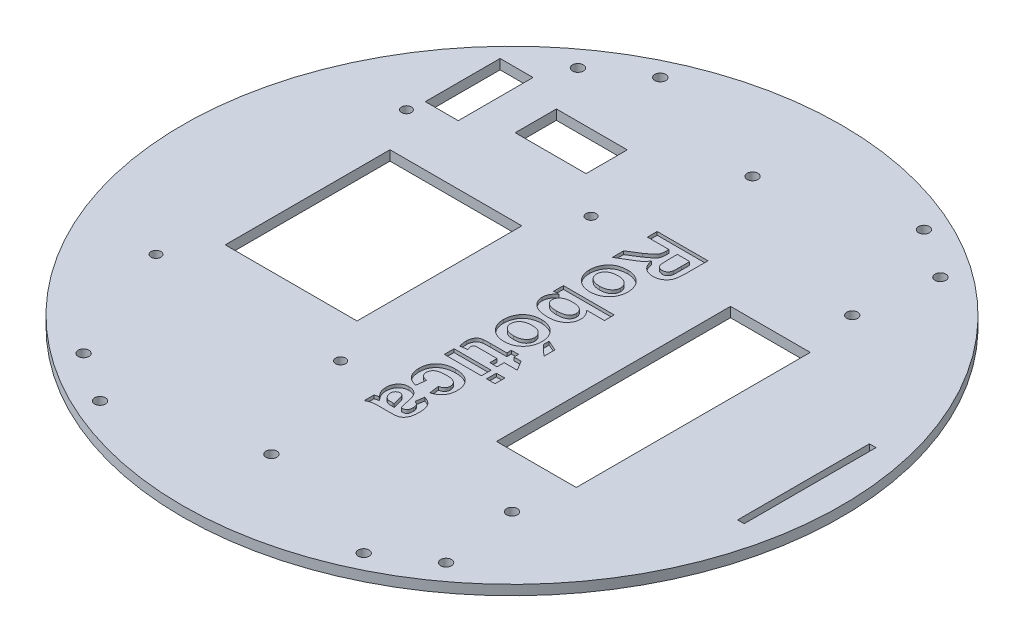
from build123d import *

# Parameters (mm, degrees)
CROQUIS1_R              = 100
CROQUIS1_R_2            = 1.65
CROQUIS1_R_3            = 1.5
CROQUIS1_W              = 24.2
CROQUIS1_H              = 71
CROQUIS1_W_2            = 10
CROQUIS1_H_2            = 22.7
CROQUIS1_W_3            = 21.5
CROQUIS1_H_3            = 12.5
CROQUIS1_W_4            = 40
CROQUIS1_H_4            = 50
CROQUIS1_W_5            = 2
CROQUIS1_H_5            = 40
SALIENTE_EXTRUIR1_DEPTH = 3
CROQUIS2_W              = 2.568318685
CROQUIS2_H              = 2.963444636
CROQUIS2_W_2            = 11.261089618
CORTAR_EXTRUIR1_DEPTH   = 1


with BuildPart() as part:
    # Croquis1 → Saliente-Extruir1 (new body)
    with BuildSketch(Plane(origin=(0, 0, 0), x_dir=(1, 0, 0), z_dir=(0, 1, 0))):
        with Locations(Location((0, 0, 0), (0, 0, 270))):
            Circle(CROQUIS1_R)
        with Locations(Location((55, 75, 0), (0, 0, 270))):
            Circle(CROQUIS1_R_2, mode=Mode.SUBTRACT)
        with Locations(Location((55, -75, 0), (0, 0, 90))):
            Circle(CROQUIS1_R_2, mode=Mode.SUBTRACT)
        with Locations(Location((0, -73, 0), (0, 0, 270))):
            Circle(CROQUIS1_R_2, mode=Mode.SUBTRACT)
        with Locations(Location((51.618795027, -51.618795027, 0), (0, 0, 270))):
            Circle(CROQUIS1_R_2, mode=Mode.SUBTRACT)
        with Locations(Location((51.618795027, 51.618795027, 0), (0, 0, 270))):
            Circle(CROQUIS1_R_2, mode=Mode.SUBTRACT)
        with Locations(Location((0, 73, 0), (0, 0, 270))):
            Circle(CROQUIS1_R_2, mode=Mode.SUBTRACT)
        with Locations(Location((40, -85, 0), (0, 0, 270))):
            Circle(CROQUIS1_R_2, mode=Mode.SUBTRACT)
        with Locations(Location((40, 85, 0), (0, 0, 90))):
            Circle(CROQUIS1_R_2, mode=Mode.SUBTRACT)
        with Locations(Location((-70.020295338, 38, 0), (0, 0, 270))):
            Circle(CROQUIS1_R_3, mode=Mode.SUBTRACT)
        with Locations(Location((-14.020295338, 38, 0), (0, 0, 270))):
            Circle(CROQUIS1_R_3, mode=Mode.SUBTRACT)
        with Locations(Location((-14.020295338, -38, 0), (0, 0, 90))):
            Circle(CROQUIS1_R_3, mode=Mode.SUBTRACT)
        with Locations(Location((-70.020295338, -38, 0), (0, 0, 90))):
            Circle(CROQUIS1_R_3, mode=Mode.SUBTRACT)
        with Locations(Location((-40, -85, 0), (0, 0, 90))):
            Circle(CROQUIS1_R_2, mode=Mode.SUBTRACT)
        with Locations(Location((-55, -75, 0), (0, 0, 270))):
            Circle(CROQUIS1_R_2, mode=Mode.SUBTRACT)
        with Locations(Location((-55, 75, 0), (0, 0, 90))):
            Circle(CROQUIS1_R_2, mode=Mode.SUBTRACT)
        with Locations(Location((-40, 85, 0), (0, 0, 270))):
            Circle(CROQUIS1_R_2, mode=Mode.SUBTRACT)
        with Locations((42.9, 0)):
            Rectangle(CROQUIS1_W, CROQUIS1_H, mode=Mode.SUBTRACT)
        with Locations((-64.299296542, 54.335107278)):
            Rectangle(CROQUIS1_W_2, CROQUIS1_H_2, mode=Mode.SUBTRACT)
        with Locations((-36.742208882, 54.713188989)):
            Rectangle(CROQUIS1_W_3, CROQUIS1_H_3, mode=Mode.SUBTRACT)
        with Locations((-42.020295338, 0)):
            Rectangle(CROQUIS1_W_4, CROQUIS1_H_4, mode=Mode.SUBTRACT)
        with Locations((89, 0.459343657)):
            Rectangle(CROQUIS1_W_5, CROQUIS1_H_5, mode=Mode.SUBTRACT)
    extrude(amount=SALIENTE_EXTRUIR1_DEPTH)

    # Croquis2 → Cortar-Extruir1 (cut)
    # profile 1 of 10: a face of its own
    with BuildSketch(Plane(origin=(0, 3, 0), x_dir=(1, 0, 0), z_dir=(0, 1, 0))):
        with BuildLine():
            Line((0, 44.056543595), (15.409912109, 44.056543595))
            Line((15.409912109, 44.056543595), (15.409912109, 37.58944306))
            add(Edge.make_bspline(
                [(15.409912109, 37.58944306), (15.408700139, 37.392901619), (15.406364449, 37.01413029), (15.389351015, 36.466350859), (15.353656515, 35.96118308), (15.313369891, 35.496351667), (15.254130983, 35.073199675), (15.184575295, 34.690710004), (15.102371123, 34.350116278), (15.005589025, 34.047662408), (14.89220702, 33.772955118), (14.759999786, 33.516154901), (14.603923989, 33.274834845), (14.430534785, 33.045831307), (14.239368077, 32.828255327), (14.025418076, 32.628050057), (13.79185615, 32.44173331), (13.5406295, 32.269453804), (13.272846352, 32.11768643), (12.997106922, 31.979010873), (12.710476846, 31.866123744), (12.414306386, 31.77288), (12.109238565, 31.698395459), (11.794497787, 31.646696895), (11.470653745, 31.614422038), (11.251906484, 31.611540857), (11.14069968, 31.610076122)],
                knots=[0, 0, 0, 0, 1.675792322, 3.229558513, 4.671612708, 5.993327294, 7.206773438, 8.313218507, 9.306927966, 10.191988363, 11.018030861, 11.838135071, 12.650980327, 13.465150207, 14.285535933, 15.117196726, 15.959844754, 16.83101188, 17.711363548, 18.582398133, 19.460517458, 20.334551361, 21.228266118, 22.135486512, 23.052118027, 24, 24, 24, 24], degree=3))
            add(Edge.make_bspline(
                [(11.14069968, 31.610076122), (11.000599617, 31.612759295), (10.72680548, 31.618002956), (10.325687671, 31.667336031), (9.941481852, 31.738245618), (9.577492248, 31.847861189), (9.230980803, 31.984155425), (8.904382122, 32.150674809), (8.5946336, 32.347195417), (8.306114692, 32.574728563), (8.038244285, 32.832361257), (7.796875347, 33.121547022), (7.579485208, 33.440374803), (7.392576035, 33.791453862), (7.227856809, 34.168732285), (7.092522492, 34.577179336), (6.981283029, 35.01468756), (6.929076027, 35.319102281), (6.902356466, 35.474901835)],
                knots=[0, 0, 0, 0, 1.059179627, 2.069928931, 3.052909591, 4.01082991, 4.940120368, 5.865982481, 6.779263376, 7.710344595, 8.640547144, 9.585223395, 10.554458868, 11.553878165, 12.589111246, 13.664634927, 14.804759383, 16, 16, 16, 16], degree=3))
            add(Edge.make_bspline(
                [(6.902356466, 35.474901835), (6.802810616, 35.324033949), (6.608430531, 35.02943892), (6.283482022, 34.624214802), (5.949212712, 34.255013926), (5.647683016, 33.977843153), (5.383771386, 33.764654987), (5.152835883, 33.593099202), (4.88709982, 33.40801717), (4.586375223, 33.211263384), (4.25333668, 32.997008803), (3.882882181, 32.773225785), (3.478626524, 32.535230155), (3.196233421, 32.375215871), (3.049878438, 32.292285772)],
                knots=[0, 0, 0, 0, 1.285482994, 2.510122655, 3.691653098, 4.826411195, 5.419869803, 6.105175889, 6.872935239, 7.723789235, 8.662129684, 9.690525463, 10.803075916, 12, 12, 12, 12], degree=3))
            Line((3.049878438, 32.292285772), (0, 30.424698267))
            Line((0, 30.424698267), (0, 33.888224186))
            Line((0, 33.888224186), (3.497482055, 36.079938448))
            add(Edge.make_bspline(
                [(3.497482055, 36.079938448), (3.637579979, 36.180560682), (3.905055719, 36.372669213), (4.284737049, 36.650527393), (4.624620583, 36.90327335), (4.922628616, 37.131197719), (5.181863001, 37.331531764), (5.395845399, 37.511128653), (5.574840785, 37.661179522), (5.752121404, 37.831220018), (5.934547724, 38.028873802), (6.110117883, 38.27330232), (6.252756198, 38.522653774), (6.359881675, 38.792397306), (6.43396371, 39.105088115), (6.482276325, 39.480465328), (6.517357105, 39.929711289), (6.518800304, 40.254400593), (6.5195782, 40.429410837)],
                knots=[0, 0, 0, 0, 1.465382114, 2.797715724, 3.99708711, 5.063614826, 5.985194575, 6.779875669, 7.43696127, 7.968700361, 8.866038685, 9.717629234, 10.520014012, 11.30082289, 12.174340694, 13.242479345, 14.513673363, 16, 16, 16, 16], degree=3))
            Line((6.5195782, 40.429410837), (6.5195782, 41.093098958))
            Line((6.5195782, 41.093098958), (0, 41.093098958))
            Line((0, 41.093098958), (0, 44.056543595))
        make_face()
        with BuildLine():
            Line((9.087896885, 41.093098958), (9.087896885, 38.706908642))
            add(Edge.make_bspline(
                [(9.087896885, 38.706908642), (9.088287797, 38.522713205), (9.089032551, 38.171789772), (9.099974618, 37.672773199), (9.10904285, 37.227998798), (9.132696583, 36.838128637), (9.155258098, 36.502349434), (9.18537091, 36.221084541), (9.2207214, 35.993968954), (9.27571103, 35.767121757), (9.37150864, 35.534743605), (9.507969633, 35.287111188), (9.684943618, 35.075331973), (9.88973085, 34.892378098), (10.129434073, 34.751153944), (10.397162987, 34.647583903), (10.692365394, 34.585732993), (10.898592997, 34.577674044), (11.004875134, 34.573520758)],
                knots=[0, 0, 0, 0, 1.698120923, 3.235207303, 4.601799022, 5.7989489, 6.835765357, 7.704239165, 8.40605236, 8.953649664, 9.852072573, 10.714567413, 11.550246753, 12.383769498, 13.234656382, 14.099651817, 15.020630301, 16, 16, 16, 16], degree=3))
            add(Edge.make_bspline(
                [(11.004875134, 34.573520758), (11.123691124, 34.578679343), (11.352927417, 34.588632), (11.677985231, 34.669611839), (11.967764752, 34.804409725), (12.217192243, 34.996867033), (12.429998406, 35.237242284), (12.595951853, 35.525782418), (12.722054455, 35.856249006), (12.768125755, 36.094394663), (12.792202681, 36.218849916)],
                knots=[0, 0, 0, 0, 1.062451802, 2.049829439, 2.976851779, 3.903462222, 4.849641532, 5.832195941, 6.867102576, 8, 8, 8, 8], degree=3))
            add(Edge.make_bspline(
                [(12.792202681, 36.218849916), (12.796721703, 36.259977358), (12.807432735, 36.357458032), (12.814311959, 36.529597345), (12.824886077, 36.749699541), (12.829207483, 37.020428737), (12.836782527, 37.339366254), (12.838173496, 37.70778033), (12.842617545, 38.124500484), (12.841947294, 38.418794186), (12.841593424, 38.574171017)],
                knots=[0, 0, 0, 0, 0.42127143, 0.998501726, 1.753681744, 2.66564073, 3.755712164, 5.002818897, 6.417592707, 8, 8, 8, 8], degree=3))
            Line((12.841593424, 38.574171017), (12.841593424, 41.093098958))
            Line((12.841593424, 41.093098958), (9.087896885, 41.093098958))
        make_face(mode=Mode.SUBTRACT)
    # profile 2 of 10: a face of its own
    with BuildSketch(Plane(origin=(0, 3, 0), x_dir=(1, 0, 0), z_dir=(0, 1, 0))):
        with BuildLine():
            add(Edge.make_bspline(
                [(5.787977806, 29.436883388), (6.031343705, 29.427309614), (6.518547235, 29.408143507), (7.242878708, 29.273126249), (7.951411517, 29.038968189), (8.525243796, 28.779609283), (8.968971023, 28.531459875), (9.282093799, 28.320887573), (9.578631102, 28.096006215), (9.849943669, 27.846863815), (10.10399132, 27.581948554), (10.336219217, 27.29699471), (10.54618146, 26.992647263), (10.737961311, 26.672386941), (10.905250038, 26.3369018), (11.056349725, 25.99300478), (11.178361623, 25.637164013), (11.280403075, 25.27231632), (11.362084313, 24.897392419), (11.415599834, 24.512392378), (11.451273379, 24.117754224), (11.456170218, 23.851693285), (11.458652594, 23.716817856)],
                knots=[0, 0, 0, 0, 1.620086906, 3.24331412, 4.885542897, 6.578005083, 7.427771567, 8.267621014, 9.088420958, 9.9031946, 10.717276681, 11.530464626, 12.347654122, 13.177156876, 14.013590352, 14.842102317, 15.676260085, 16.515690285, 17.363576751, 18.228778874, 19.102107167, 20, 20, 20, 20], degree=3))
            add(Edge.make_bspline(
                [(11.458652594, 23.716817856), (11.454267138, 23.511809641), (11.44564005, 23.108516544), (11.367088975, 22.518108154), (11.237604413, 21.956862167), (11.057560605, 21.423843835), (10.825488748, 20.918495221), (10.540220114, 20.441875582), (10.204185516, 19.993696617), (9.819759083, 19.580722035), (9.398381958, 19.20373864), (8.944142898, 18.875682398), (8.461611024, 18.600655775), (7.955925649, 18.368485743), (7.420206891, 18.193185307), (6.857228462, 18.071798056), (6.268806062, 17.990588865), (5.866459824, 17.982402681), (5.661414024, 17.978230794)],
                knots=[0, 0, 0, 0, 1.075924834, 2.116564253, 3.120359295, 4.095843642, 5.065160291, 6.034266158, 7.006679049, 8.000613031, 8.991650547, 9.970718501, 10.936294465, 11.903365421, 12.887384013, 13.888792113, 14.924075166, 16, 16, 16, 16], degree=3))
            add(Edge.make_bspline(
                [(5.661414024, 17.978230794), (5.454315166, 17.982409763), (5.048899281, 17.990590496), (4.455078454, 18.071450183), (3.886886153, 18.195900643), (3.347002526, 18.376429344), (2.831024993, 18.601812898), (2.346191007, 18.884989394), (1.887187236, 19.216895283), (1.459711587, 19.594961335), (1.072849761, 20.013375439), (0.730970958, 20.460451468), (0.446328394, 20.937146308), (0.209047557, 21.43658351), (0.026191293, 21.96463528), (-0.101122858, 22.51947737), (-0.185910466, 23.099915779), (-0.193629583, 23.496308467), (-0.197562976, 23.698296327)],
                knots=[0, 0, 0, 0, 1.084214369, 2.122453651, 3.133245126, 4.126920621, 5.099393651, 6.077466609, 7.061801406, 8.062192921, 9.061451275, 10.042415863, 11.00466351, 11.964250754, 12.934136361, 13.925118567, 14.942712938, 16, 16, 16, 16], degree=3))
            add(Edge.make_bspline(
                [(-0.197562976, 23.698296327), (-0.189319439, 23.949918488), (-0.17289102, 24.45137244), (-0.038163459, 25.193430348), (0.179280235, 25.917113057), (0.429362043, 26.500293067), (0.673676214, 26.945452546), (0.877719169, 27.261331758), (1.101381395, 27.55663592), (1.345017986, 27.832176615), (1.611339205, 28.085081066), (1.896013272, 28.317481849), (2.200857031, 28.528457988), (2.524751691, 28.719286446), (2.868276624, 28.891176297), (3.233615716, 29.032990665), (3.613585497, 29.162149017), (4.01311313, 29.263339484), (4.430986897, 29.339681399), (4.866904207, 29.394810444), (5.321296338, 29.429452828), (5.630482296, 29.434375725), (5.787977806, 29.436883388)],
                knots=[0, 0, 0, 0, 1.611045457, 3.210627817, 4.814333868, 6.444163167, 7.264332963, 8.065176076, 8.850929033, 9.63538137, 10.418669626, 11.201097567, 11.987375694, 12.791170411, 13.607756286, 14.445019158, 15.299668816, 16.177394151, 17.082417834, 18.019405111, 18.991109422, 20, 20, 20, 20], degree=3))
        make_face()
        with BuildLine():
            add(Edge.make_bspline(
                [(5.630544809, 26.473438752), (5.487423985, 26.471242449), (5.208910824, 26.466968442), (4.803691732, 26.428875531), (4.42316774, 26.369833475), (4.070876199, 26.278656115), (3.742056526, 26.168705164), (3.441082057, 26.029134415), (3.162252667, 25.869649956), (2.915998515, 25.679845623), (2.698014315, 25.472977314), (2.504323065, 25.25615924), (2.33939629, 25.027264805), (2.205306621, 24.784888136), (2.103511456, 24.529328825), (2.028814736, 24.263602844), (1.984932618, 23.985799091), (1.978764821, 23.797231361), (1.975629758, 23.701383248)],
                knots=[0, 0, 0, 0, 1.334287467, 2.596523749, 3.792235791, 4.920928783, 5.98599801, 7.020725633, 8.009778093, 8.975087571, 9.91178927, 10.809031968, 11.682407688, 12.537028737, 13.385161363, 14.241880569, 15.106355953, 16, 16, 16, 16], degree=3))
            add(Edge.make_bspline(
                [(1.975629758, 23.701383248), (1.978754531, 23.605530981), (1.984902085, 23.416955078), (2.028931794, 23.139210915), (2.102821587, 22.87418335), (2.206138393, 22.620279167), (2.339274569, 22.378529615), (2.504433452, 22.149777711), (2.697215413, 21.933116015), (2.91637568, 21.72792993), (3.165982934, 21.543617007), (3.443941874, 21.382569703), (3.746068445, 21.243003261), (4.076632238, 21.132544287), (4.432978138, 21.046363947), (4.81597365, 20.98592639), (5.225398483, 20.948140966), (5.506981424, 20.943874852), (5.65215326, 20.941675431)],
                knots=[0, 0, 0, 0, 0.891374549, 1.753654511, 2.608197993, 3.445305504, 4.297756158, 5.168913853, 6.063877914, 6.991658187, 7.956416983, 8.942957645, 9.975057474, 11.046479855, 12.179282068, 13.381405243, 14.649967197, 16, 16, 16, 16], degree=3))
            add(Edge.make_bspline(
                [(5.65215326, 20.941675431), (5.79423675, 20.943885767), (6.069654834, 20.948170336), (6.469891763, 20.985742726), (6.845473594, 21.047189845), (7.196021316, 21.13188322), (7.522133708, 21.243576576), (7.820794508, 21.383443558), (8.097944556, 21.542558085), (8.344939861, 21.729007309), (8.563970166, 21.9329857), (8.756631577, 22.149811104), (8.921821411, 22.378520976), (9.054949572, 22.620281413), (9.158268481, 22.874182739), (9.232157702, 23.13921108), (9.276187565, 23.416955035), (9.282335098, 23.605530967), (9.285459861, 23.701383248)],
                knots=[0, 0, 0, 0, 1.332105243, 2.582185114, 3.76554119, 4.898206757, 5.96011018, 6.991864232, 7.986448439, 8.951336849, 9.886681577, 10.788942532, 11.667203022, 12.526603947, 13.370536632, 14.232047448, 15.101357822, 16, 16, 16, 16], degree=3))
            add(Edge.make_bspline(
                [(9.285459861, 23.701383248), (9.282324798, 23.797231361), (9.276157001, 23.985799091), (9.232274882, 24.263602844), (9.157578163, 24.529328825), (9.055782997, 24.784888136), (8.921693328, 25.027264805), (8.756766553, 25.25615924), (8.563075304, 25.472977314), (8.345091103, 25.679845623), (8.098836952, 25.869649956), (7.820007561, 26.029134415), (7.519033093, 26.168705164), (7.19021342, 26.278656115), (6.837921878, 26.369833475), (6.457397886, 26.428875531), (6.052178794, 26.466968442), (5.773665634, 26.471242449), (5.630544809, 26.473438752)],
                knots=[0, 0, 0, 0, 0.893644047, 1.758119431, 2.614838637, 3.462971263, 4.317592312, 5.190968032, 6.08821073, 7.024912429, 7.990221907, 8.979274367, 10.01400199, 11.079071217, 12.207764209, 13.403476251, 14.665712533, 16, 16, 16, 16], degree=3))
        make_face(mode=Mode.SUBTRACT)
    # profile 3 of 10: a face of its own
    with BuildSketch(Plane(origin=(0, 3, 0), x_dir=(1, 0, 0), z_dir=(0, 1, 0))):
        with BuildLine():
            Line((0, 15.607475085), (15.409912109, 15.607475085))
            Line((15.409912109, 15.607475085), (15.409912109, 12.644030449))
            Line((15.409912109, 12.644030449), (9.918278768, 12.644030449))
            add(Edge.make_bspline(
                [(9.918278768, 12.644030449), (10.040893651, 12.533098933), (10.279798396, 12.316958243), (10.594130567, 11.961024967), (10.861732366, 11.590659182), (11.077926301, 11.202307601), (11.251556679, 10.800954612), (11.370809818, 10.382750615), (11.444368389, 9.948657001), (11.453843389, 9.65412584), (11.458652594, 9.504631287)],
                knots=[0, 0, 0, 0, 1.09742733, 2.138244462, 3.14714167, 4.12618092, 5.084514129, 6.044794579, 7.007600552, 8, 8, 8, 8], degree=3))
            add(Edge.make_bspline(
                [(11.458652594, 9.504631287), (11.455318828, 9.342773371), (11.448786873, 9.025640016), (11.373186716, 8.561644449), (11.260814334, 8.118164672), (11.099793172, 7.694630541), (10.887407354, 7.295508617), (10.632092596, 6.915703143), (10.33204903, 6.556707508), (9.985454457, 6.223467619), (9.596850412, 5.920106879), (9.16455505, 5.657037132), (8.692493452, 5.434426834), (8.180448311, 5.252595438), (7.62764793, 5.111031772), (7.035121241, 5.01005752), (6.402393569, 4.95227227), (5.968166612, 4.943557871), (5.744760905, 4.939074394)],
                knots=[0, 0, 0, 0, 0.942645034, 1.846954357, 2.732936073, 3.606279831, 4.480961418, 5.362669002, 6.269659826, 7.202907134, 8.160359116, 9.13763422, 10.146465205, 11.197528604, 12.300274984, 13.468806273, 14.697724511, 16, 16, 16, 16], degree=3))
            add(Edge.make_bspline(
                [(5.744760905, 4.939074394), (5.513139013, 4.943594456), (5.063533878, 4.952368423), (4.409085365, 5.009429101), (3.796873819, 5.112771545), (3.223171614, 5.247785805), (2.693406497, 5.432554431), (2.200991327, 5.649785329), (1.752452007, 5.914430386), (1.344082003, 6.212498899), (0.984225109, 6.543917664), (0.667775208, 6.892282409), (0.398761202, 7.258585172), (0.182502183, 7.644020946), (0.009647831, 8.044747148), (-0.110157296, 8.463850914), (-0.183205643, 8.900122699), (-0.19272935, 9.19668313), (-0.197562976, 9.347198291)],
                knots=[0, 0, 0, 0, 1.342870887, 2.606669183, 3.804116642, 4.939900444, 6.019000177, 7.05232885, 8.054982388, 9.032166237, 9.977983042, 10.886081202, 11.757115518, 12.60655571, 13.443120694, 14.281385496, 15.127740887, 16, 16, 16, 16], degree=3))
            add(Edge.make_bspline(
                [(-0.197562976, 9.347198291), (-0.192080272, 9.497773854), (-0.181069316, 9.800175931), (-0.095338296, 10.250892638), (0.050909895, 10.695377198), (0.243234794, 11.136540526), (0.494053737, 11.563770322), (0.815514642, 11.957136969), (1.189659999, 12.326802717), (1.478702036, 12.53655371), (1.626807629, 12.644030449)],
                knots=[0, 0, 0, 0, 0.921225307, 1.850103952, 2.796138694, 3.780250544, 4.791200767, 5.817047773, 6.881451854, 8, 8, 8, 8], degree=3))
            Line((1.626807629, 12.644030449), (0, 12.644030449))
            Line((0, 12.644030449), (0, 15.607475085))
        make_face()
        with BuildLine():
            add(Edge.make_bspline(
                [(5.843542392, 12.644030449), (5.698420033, 12.642147097), (5.418247062, 12.638511101), (5.013447537, 12.613776969), (4.638412297, 12.574079632), (4.291760308, 12.519605697), (3.973239931, 12.447374984), (3.685865336, 12.352262019), (3.423299487, 12.251894193), (3.267080349, 12.162356856), (3.191876827, 12.119253794)],
                knots=[0, 0, 0, 0, 1.273962591, 2.459509927, 3.558811407, 4.583506862, 5.538845358, 6.421555731, 7.240140678, 8, 8, 8, 8], degree=3))
            add(Edge.make_bspline(
                [(3.191876827, 12.119253794), (3.095730076, 12.057515866), (2.909148674, 11.937707874), (2.661170047, 11.728834174), (2.448046807, 11.50708258), (2.277660187, 11.265320399), (2.13832747, 11.013260665), (2.04706042, 10.741057455), (1.984896496, 10.457204314), (1.9787429, 10.261269956), (1.975629758, 10.162145566)],
                knots=[0, 0, 0, 0, 1.13317841, 2.199034441, 3.210601728, 4.17712673, 5.127651621, 6.057985678, 7.017523073, 8, 8, 8, 8], degree=3))
            add(Edge.make_bspline(
                [(1.975629758, 10.162145566), (1.977614372, 10.084774448), (1.981506278, 9.933046702), (2.023990949, 9.710121931), (2.091187096, 9.495983596), (2.189671106, 9.291245871), (2.30856459, 9.092334668), (2.460502097, 8.905821934), (2.636661627, 8.727660802), (2.837566073, 8.555508457), (3.070856544, 8.401630479), (3.333703518, 8.264573053), (3.631157979, 8.154874434), (3.957638045, 8.063673486), (4.314274139, 7.988984217), (4.702181948, 7.9376847), (5.120690231, 7.906767787), (5.410288372, 7.903964057), (5.559545615, 7.90251903)],
                knots=[0, 0, 0, 0, 0.783629253, 1.536727179, 2.292350471, 3.053142441, 3.835102916, 4.636791621, 5.485252556, 6.373638325, 7.314106871, 8.312735544, 9.372705313, 10.522103146, 11.747813537, 13.06401469, 14.486809783, 16, 16, 16, 16], degree=3))
            add(Edge.make_bspline(
                [(5.559545615, 7.90251903), (5.719090424, 7.903911837), (6.02616002, 7.906592518), (6.46933094, 7.937693043), (6.878714233, 7.989314726), (7.253208211, 8.062257895), (7.594264865, 8.1547396), (7.90091752, 8.267881899), (8.173434782, 8.403062505), (8.411937526, 8.558631978), (8.615730507, 8.734248252), (8.79586785, 8.91741968), (8.945674816, 9.115393962), (9.070631533, 9.322626544), (9.167338615, 9.543674526), (9.233941206, 9.77742692), (9.280268423, 10.021410418), (9.283716166, 10.188678836), (9.285459861, 10.27327474)],
                knots=[0, 0, 0, 0, 1.541513452, 2.96689009, 4.290257245, 5.526600419, 6.650730858, 7.701629612, 8.679929421, 9.584504318, 10.445167401, 11.274948755, 12.062487509, 12.838390235, 13.608729945, 14.385905896, 15.183672854, 16, 16, 16, 16], degree=3))
            add(Edge.make_bspline(
                [(9.285459861, 10.27327474), (9.283423883, 10.356788786), (9.279427468, 10.52071825), (9.237792042, 10.761278668), (9.16960002, 10.989887402), (9.076487821, 11.209160567), (8.954221751, 11.41608765), (8.809285376, 11.615348144), (8.634526834, 11.801169599), (8.433494599, 11.973465218), (8.206359594, 12.133006258), (7.950746996, 12.271236601), (7.665219209, 12.385231519), (7.354446908, 12.480186254), (7.015817702, 12.554325526), (6.649379314, 12.604774784), (6.255847183, 12.640852242), (5.983571799, 12.642951047), (5.843542392, 12.644030449)],
                knots=[0, 0, 0, 0, 0.853654749, 1.675636261, 2.488263676, 3.289909134, 4.105938102, 4.941754496, 5.805666242, 6.708768126, 7.646124924, 8.639937881, 9.673965161, 10.786053658, 11.960883777, 13.21578984, 14.568099356, 16, 16, 16, 16], degree=3))
        make_face(mode=Mode.SUBTRACT)
    # profile 4 of 10: a face of its own
    with BuildSketch(Plane(origin=(0, 3, 0), x_dir=(1, 0, 0), z_dir=(0, 1, 0))):
        with BuildLine():
            add(Edge.make_bspline(
                [(5.787977806, 3.358570588), (6.031343705, 3.348996813), (6.518547235, 3.329830706), (7.242878708, 3.194813448), (7.951411517, 2.960655388), (8.525243796, 2.701296483), (8.968971023, 2.453147075), (9.282093799, 2.242574773), (9.578631102, 2.017693414), (9.849943669, 1.768551015), (10.10399132, 1.503635754), (10.336219217, 1.21868191), (10.54618146, 0.914334462), (10.737961311, 0.59407414), (10.905250038, 0.258588999), (11.056349725, -0.085308021), (11.178361623, -0.441148788), (11.280403075, -0.805996481), (11.362084313, -1.180920382), (11.415599834, -1.565920422), (11.451273379, -1.960558577), (11.456170218, -2.226619515), (11.458652594, -2.361494945)],
                knots=[0, 0, 0, 0, 1.620086906, 3.24331412, 4.885542897, 6.578005083, 7.427771567, 8.267621014, 9.088420958, 9.9031946, 10.717276681, 11.530464626, 12.347654122, 13.177156876, 14.013590352, 14.842102317, 15.676260085, 16.515690285, 17.363576751, 18.228778874, 19.102107167, 20, 20, 20, 20], degree=3))
            add(Edge.make_bspline(
                [(11.458652594, -2.361494945), (11.454267138, -2.566503159), (11.44564005, -2.969796256), (11.367088975, -3.560204646), (11.237604413, -4.121450633), (11.057560605, -4.654468966), (10.825488748, -5.159817579), (10.540220114, -5.636437218), (10.204185516, -6.084616184), (9.819759083, -6.497590766), (9.398381958, -6.874574161), (8.944142898, -7.202630402), (8.461611024, -7.477657025), (7.955925649, -7.709827057), (7.420206891, -7.885127494), (6.857228462, -8.006514745), (6.268806062, -8.087723935), (5.866459824, -8.09591012), (5.661414024, -8.100082006)],
                knots=[0, 0, 0, 0, 1.075924834, 2.116564253, 3.120359295, 4.095843642, 5.065160291, 6.034266158, 7.006679049, 8.000613031, 8.991650547, 9.970718501, 10.936294465, 11.903365421, 12.887384013, 13.888792113, 14.924075166, 16, 16, 16, 16], degree=3))
            add(Edge.make_bspline(
                [(5.661414024, -8.100082006), (5.454315166, -8.095903037), (5.048899281, -8.087722304), (4.455078454, -8.006862618), (3.886886153, -7.882412157), (3.347002526, -7.701883456), (2.831024993, -7.476499902), (2.346191007, -7.193323407), (1.887187236, -6.861417517), (1.459711587, -6.483351466), (1.072849761, -6.064937362), (0.730970958, -5.617861333), (0.446328394, -5.141166493), (0.209047557, -4.64172929), (0.026191293, -4.11367752), (-0.101122858, -3.55883543), (-0.185910466, -2.978397022), (-0.193629583, -2.582004334), (-0.197562976, -2.380016474)],
                knots=[0, 0, 0, 0, 1.084214369, 2.122453651, 3.133245126, 4.126920621, 5.099393651, 6.077466609, 7.061801406, 8.062192921, 9.061451275, 10.042415863, 11.00466351, 11.964250754, 12.934136361, 13.925118567, 14.942712938, 16, 16, 16, 16], degree=3))
            add(Edge.make_bspline(
                [(-0.197562976, -2.380016474), (-0.189319439, -2.128394312), (-0.17289102, -1.626940361), (-0.038163459, -0.884882453), (0.179280235, -0.161199743), (0.429362043, 0.421980266), (0.673676214, 0.867139745), (0.877719169, 1.183018957), (1.101381395, 1.47832312), (1.345017986, 1.753863815), (1.611339205, 2.006768266), (1.896013272, 2.239169049), (2.200857031, 2.450145187), (2.524751691, 2.640973645), (2.868276624, 2.812863497), (3.233615716, 2.954677865), (3.613585497, 3.083836217), (4.01311313, 3.185026683), (4.430986897, 3.261368599), (4.866904207, 3.316497644), (5.321296338, 3.351140028), (5.630482296, 3.356062925), (5.787977806, 3.358570588)],
                knots=[0, 0, 0, 0, 1.611045457, 3.210627817, 4.814333868, 6.444163167, 7.264332963, 8.065176076, 8.850929033, 9.63538137, 10.418669626, 11.201097567, 11.987375694, 12.791170411, 13.607756286, 14.445019158, 15.299668816, 16.177394151, 17.082417834, 18.019405111, 18.991109422, 20, 20, 20, 20], degree=3))
        make_face()
        with BuildLine():
            add(Edge.make_bspline(
                [(5.630544809, 0.395125952), (5.487423985, 0.392929648), (5.208910824, 0.388655642), (4.803691732, 0.350562731), (4.42316774, 0.291520675), (4.070876199, 0.200343314), (3.742056526, 0.090392364), (3.441082057, -0.049178386), (3.162252667, -0.208662844), (2.915998515, -0.398467178), (2.698014315, -0.605335486), (2.504323065, -0.822153561), (2.33939629, -1.051047996), (2.205306621, -1.293424664), (2.103511456, -1.548983975), (2.028814736, -1.814709957), (1.984932618, -2.09251371), (1.978764821, -2.281081439), (1.975629758, -2.376929552)],
                knots=[0, 0, 0, 0, 1.334287467, 2.596523749, 3.792235791, 4.920928783, 5.98599801, 7.020725633, 8.009778093, 8.975087571, 9.91178927, 10.809031968, 11.682407688, 12.537028737, 13.385161363, 14.241880569, 15.106355953, 16, 16, 16, 16], degree=3))
            add(Edge.make_bspline(
                [(1.975629758, -2.376929552), (1.978754531, -2.472781819), (1.984902085, -2.661357722), (2.028931794, -2.939101886), (2.102821587, -3.20412945), (2.206138393, -3.458033634), (2.339274569, -3.699783185), (2.504433452, -3.928535089), (2.697215413, -4.145196786), (2.91637568, -4.35038287), (3.165982934, -4.534695794), (3.443941874, -4.695743097), (3.746068445, -4.835309539), (4.076632238, -4.945768514), (4.432978138, -5.031948854), (4.81597365, -5.092386411), (5.225398483, -5.130171835), (5.506981424, -5.134437948), (5.65215326, -5.13663737)],
                knots=[0, 0, 0, 0, 0.891374549, 1.753654511, 2.608197993, 3.445305504, 4.297756158, 5.168913853, 6.063877914, 6.991658187, 7.956416983, 8.942957645, 9.975057474, 11.046479855, 12.179282068, 13.381405243, 14.649967197, 16, 16, 16, 16], degree=3))
            add(Edge.make_bspline(
                [(5.65215326, -5.13663737), (5.79423675, -5.134427034), (6.069654834, -5.130142464), (6.469891763, -5.092570075), (6.845473594, -5.031122956), (7.196021316, -4.946429581), (7.522133708, -4.834736225), (7.820794508, -4.694869243), (8.097944556, -4.535754716), (8.344939861, -4.349305491), (8.563970166, -4.145327101), (8.756631577, -3.928501697), (8.921821411, -3.699791824), (9.054949572, -3.458031388), (9.158268481, -3.204130061), (9.232157702, -2.93910172), (9.276187565, -2.661357766), (9.282335098, -2.472781834), (9.285459861, -2.376929552)],
                knots=[0, 0, 0, 0, 1.332105243, 2.582185114, 3.76554119, 4.898206757, 5.96011018, 6.991864232, 7.986448439, 8.951336849, 9.886681577, 10.788942532, 11.667203022, 12.526603947, 13.370536632, 14.232047448, 15.101357822, 16, 16, 16, 16], degree=3))
            add(Edge.make_bspline(
                [(9.285459861, -2.376929552), (9.282324798, -2.281081439), (9.276157001, -2.09251371), (9.232274882, -1.814709957), (9.157578163, -1.548983975), (9.055782997, -1.293424664), (8.921693328, -1.051047996), (8.756766553, -0.822153561), (8.563075304, -0.605335486), (8.345091103, -0.398467178), (8.098836952, -0.208662844), (7.820007561, -0.049178386), (7.519033093, 0.090392364), (7.19021342, 0.200343314), (6.837921878, 0.291520675), (6.457397886, 0.350562731), (6.052178794, 0.388655642), (5.773665634, 0.392929648), (5.630544809, 0.395125952)],
                knots=[0, 0, 0, 0, 0.893644047, 1.758119431, 2.614838637, 3.462971263, 4.317592312, 5.190968032, 6.08821073, 7.024912429, 7.990221907, 8.979274367, 10.01400199, 11.079071217, 12.207764209, 13.403476251, 14.665712533, 16, 16, 16, 16], degree=3))
        make_face(mode=Mode.SUBTRACT)
    # profile 5 of 10: a face of its own
    with BuildSketch(Plane(origin=(0, 3, 0), x_dir=(1, 0, 0), z_dir=(0, 1, 0))):
        Polygon((12.446467473, -1.185377855), (15.607475085, -2.568318685), (15.607475085, -5.926889273), (12.446467473, -2.963444636), align=None)
    # profile 6 of 10: a face of its own
    with BuildSketch(Plane(origin=(0, 3, 0), x_dir=(1, 0, 0), z_dir=(0, 1, 0))):
        with BuildLine():
            Line((11.261089618, -15.805038061), (9.087896885, -15.805038061))
            Line((9.087896885, -15.805038061), (9.087896885, -13.631845328))
            Line((9.087896885, -13.631845328), (4.247603979, -13.631845328))
            add(Edge.make_bspline(
                [(4.247603979, -13.631845328), (4.131330577, -13.631641167), (3.912155215, -13.631256325), (3.60239761, -13.633788064), (3.330794436, -13.641188802), (3.09711132, -13.645539785), (2.901670347, -13.656011789), (2.745101664, -13.663829127), (2.626362224, -13.674964393), (2.482416406, -13.701588321), (2.302614094, -13.779061639), (2.151386594, -13.92803655), (2.062116956, -14.074775228), (2.011380221, -14.198499493), (1.979949057, -14.334094973), (1.977089921, -14.429128253), (1.975629758, -14.477661818)],
                knots=[0, 0, 0, 0, 1.773599637, 3.343235314, 4.724802322, 5.918078765, 6.908020279, 7.709878159, 8.309605123, 8.725167438, 9.94114383, 11.228754835, 11.890951744, 12.552590386, 13.260806876, 14, 14, 14, 14], degree=3))
            add(Edge.make_bspline(
                [(1.975629758, -14.477661818), (1.980050979, -14.557099794), (1.989771609, -14.731754523), (2.048047878, -15.016448405), (2.137265752, -15.347115265), (2.217006739, -15.58116315), (2.259626535, -15.706256573)],
                knots=[0, 0, 0, 0, 0.75345353, 1.656565626, 2.747486109, 4, 4, 4, 4], degree=3))
            Line((2.259626535, -15.706256573), (0.194476054, -16.002601037))
            add(Edge.make_bspline(
                [(0.194476054, -16.002601037), (0.132676998, -15.822654359), (0.006633529, -15.455640604), (-0.106428531, -14.872302592), (-0.184971093, -14.257563595), (-0.193293195, -13.835859403), (-0.197562976, -13.619497642)],
                knots=[0, 0, 0, 0, 0.939563481, 1.916305015, 2.930928536, 4, 4, 4, 4], degree=3))
            add(Edge.make_bspline(
                [(-0.197562976, -13.619497642), (-0.193614804, -13.486623555), (-0.185904795, -13.227146392), (-0.137035421, -12.847186671), (-0.050385176, -12.488307073), (0.069044478, -12.153086622), (0.215805132, -11.850349506), (0.380540466, -11.583714309), (0.572191599, -11.364997794), (0.783724067, -11.182301101), (1.02934045, -11.038198326), (1.308840022, -10.923795935), (1.623453757, -10.825476815), (1.848466019, -10.785199797), (1.966368993, -10.764095257)],
                knots=[0, 0, 0, 0, 1.203015215, 2.349253984, 3.460901624, 4.539344044, 5.564274864, 6.502382232, 7.367332183, 8.186789841, 9.022345106, 9.932420497, 10.916620053, 12, 12, 12, 12], degree=3))
            add(Edge.make_bspline(
                [(1.966368993, -10.764095257), (2.015729722, -10.756695268), (2.125549034, -10.740231539), (2.307516298, -10.717893797), (2.523954724, -10.704110523), (2.774089428, -10.692815617), (3.057973286, -10.678327097), (3.375051074, -10.675263844), (3.725874646, -10.666398072), (3.970802653, -10.667711118), (4.099431747, -10.668400691)],
                knots=[0, 0, 0, 0, 0.560521704, 1.24706641, 2.057998689, 2.995119087, 4.059211621, 5.249632546, 6.555586685, 8, 8, 8, 8], degree=3))
            Line((4.099431747, -10.668400691), (9.087896885, -10.668400691))
            Line((9.087896885, -10.668400691), (9.087896885, -9.285459861))
            Line((9.087896885, -9.285459861), (11.261089618, -9.285459861))
            Line((11.261089618, -9.285459861), (11.261089618, -10.668400691))
            Line((11.261089618, -10.668400691), (13.434282352, -10.668400691))
            Line((13.434282352, -10.668400691), (15.212349134, -13.631845328))
            Line((15.212349134, -13.631845328), (11.261089618, -13.631845328))
            Line((11.261089618, -13.631845328), (11.261089618, -15.805038061))
        make_face()
    # profile 7 of 10: a face of its own
    with BuildSketch(Plane(origin=(0, 3, 0), x_dir=(1, 0, 0), z_dir=(0, 1, 0))):
        with Locations((14.125752766, -19.064827161)):
            Rectangle(CROQUIS2_W, CROQUIS2_H)
    # profile 8 of 10: a face of its own
    with BuildSketch(Plane(origin=(0, 3, 0), x_dir=(1, 0, 0), z_dir=(0, 1, 0))):
        with Locations((5.630544809, -19.064827161)):
            Rectangle(CROQUIS2_W_2, CROQUIS2_H)
    # profile 9 of 10: a face of its own
    with BuildSketch(Plane(origin=(0, 3, 0), x_dir=(1, 0, 0), z_dir=(0, 1, 0))):
        with BuildLine():
            Line((7.90251903, -32.795453976), (7.507393079, -29.83200934))
            add(Edge.make_bspline(
                [(7.507393079, -29.83200934), (7.646150545, -29.804750013), (7.910866992, -29.752745662), (8.277787879, -29.621285492), (8.587890429, -29.440464111), (8.845920269, -29.218538434), (9.041106794, -28.950424916), (9.187094036, -28.649179536), (9.270988397, -28.308431264), (9.280512522, -28.069838252), (9.285459861, -27.945900306)],
                knots=[0, 0, 0, 0, 1.183341972, 2.257536764, 3.246308208, 4.17453033, 5.086285291, 6.00364311, 6.962985663, 8, 8, 8, 8], degree=3))
            add(Edge.make_bspline(
                [(9.285459861, -27.945900306), (9.283139962, -27.861407575), (9.278617944, -27.696711766), (9.241760431, -27.455803847), (9.174941613, -27.230128894), (9.089898444, -27.013917251), (8.974061722, -26.814277903), (8.837142578, -26.625296614), (8.67157653, -26.452891009), (8.482342013, -26.291268568), (8.264105388, -26.142664543), (8.008700522, -26.022241134), (7.722657069, -25.9166489), (7.402253598, -25.830830958), (7.048170949, -25.764667506), (6.660732087, -25.714870277), (6.240076456, -25.688260785), (5.948532656, -25.684920342), (5.79723857, -25.683186849)],
                knots=[0, 0, 0, 0, 0.862078219, 1.680389174, 2.478024961, 3.259954283, 4.04533088, 4.826625376, 5.636266677, 6.477958853, 7.363321064, 8.321359119, 9.351280941, 10.472100686, 11.701575432, 13.024867311, 14.456081111, 16, 16, 16, 16], degree=3))
            add(Edge.make_bspline(
                [(5.79723857, -25.683186849), (5.629458605, -25.684519868), (5.305936488, -25.687090265), (4.839340346, -25.719076256), (4.411570533, -25.766798393), (4.021353426, -25.833868654), (3.67038471, -25.922550384), (3.3553688, -26.029612574), (3.079153163, -26.158023161), (2.841776642, -26.309141682), (2.635030843, -26.472245368), (2.462221522, -26.655425063), (2.308245559, -26.844407299), (2.187703369, -27.05264193), (2.089606249, -27.271190279), (2.027789856, -27.507188892), (1.980406553, -27.753651709), (1.977240406, -27.924045025), (1.975629758, -28.010725657)],
                knots=[0, 0, 0, 0, 1.594747312, 3.075075311, 4.443761234, 5.68531354, 6.835985951, 7.881615482, 8.844292363, 9.723591022, 10.55160721, 11.340262841, 12.113293914, 12.863202931, 13.621045027, 14.382916887, 15.17737509, 16, 16, 16, 16], degree=3))
            add(Edge.make_bspline(
                [(1.975629758, -28.010725657), (1.980943012, -28.137948796), (1.991206858, -28.383711292), (2.088001276, -28.733448669), (2.240079562, -29.048413375), (2.419680009, -29.278860975), (2.597960264, -29.439579097), (2.754047241, -29.552715881), (2.93399533, -29.654903625), (3.133227642, -29.751226896), (3.357808591, -29.83213524), (3.60086139, -29.911225065), (3.867863161, -29.973954228), (4.053018151, -30.0106071), (4.148822491, -30.029572316)],
                knots=[0, 0, 0, 0, 1.392166442, 2.689308738, 3.945581146, 5.207110371, 5.862003476, 6.57280888, 7.315828431, 8.128231816, 8.995711689, 9.930487288, 10.929176575, 12, 12, 12, 12], degree=3))
            Line((4.148822491, -30.029572316), (3.753696539, -32.993016952))
            add(Edge.make_bspline(
                [(3.753696539, -32.993016952), (3.595651768, -32.954033517), (3.285911319, -32.87763272), (2.841382214, -32.728616673), (2.424450501, -32.55644856), (2.039540158, -32.354899933), (1.680868583, -32.133383936), (1.355934845, -31.882061789), (1.061126307, -31.605383095), (0.793500668, -31.305203227), (0.558253296, -30.97737945), (0.357366869, -30.621265676), (0.18311213, -30.242103822), (0.045910734, -29.833635315), (-0.067148697, -29.400941585), (-0.141611408, -28.939914624), (-0.189430815, -28.45317239), (-0.194805993, -28.119917195), (-0.197562976, -27.948987227)],
                knots=[0, 0, 0, 0, 1.110304846, 2.176005688, 3.195659984, 4.184837708, 5.137434623, 6.068494488, 6.982455506, 7.892606254, 8.808345356, 9.729692418, 10.678556288, 11.651048858, 12.665954464, 13.726694543, 14.833998589, 16, 16, 16, 16], degree=3))
            add(Edge.make_bspline(
                [(-0.197562976, -27.948987227), (-0.192826506, -27.754289126), (-0.183596174, -27.37486555), (-0.111464336, -26.820651208), (0.008303421, -26.296067712), (0.178063453, -25.801444536), (0.394994395, -25.336840143), (0.663243305, -24.904543892), (0.979450352, -24.502292729), (1.341230278, -24.131383788), (1.744912502, -23.797607757), (2.190155928, -23.509466411), (2.671422136, -23.264973914), (3.189194118, -23.063493684), (3.745940074, -22.909824974), (4.338837338, -22.800754581), (4.968256212, -22.730383434), (5.399859503, -22.72335037), (5.621284045, -22.719742213)],
                knots=[0, 0, 0, 0, 1.055989068, 2.057889347, 3.026083074, 3.97053892, 4.889509418, 5.801946142, 6.724351992, 7.659923636, 8.607673148, 9.559900125, 10.531050372, 11.5314099, 12.568881852, 13.659350276, 14.799181328, 16, 16, 16, 16], degree=3))
            add(Edge.make_bspline(
                [(5.621284045, -22.719742213), (5.844765477, -22.723359753), (6.280471799, -22.730412622), (6.915025693, -22.800582751), (7.512154464, -22.909534778), (8.071045679, -23.064517342), (8.592712638, -23.260377736), (9.073883202, -23.506709951), (9.519343719, -23.794398734), (9.9227649, -24.128457482), (10.284916072, -24.498240835), (10.598409759, -24.90297568), (10.866286078, -25.336833283), (11.082252872, -25.803840613), (11.253903488, -26.300921866), (11.372350724, -26.83003056), (11.444726785, -27.39030553), (11.453930762, -27.773836354), (11.458652594, -27.970595678)],
                knots=[0, 0, 0, 0, 1.206261992, 2.351765734, 3.442553085, 4.480484798, 5.479315179, 6.445885781, 7.393622348, 8.336902565, 9.26806234, 10.182699256, 11.09556262, 12.0152312, 12.955233282, 13.92969179, 14.937888647, 16, 16, 16, 16], degree=3))
            add(Edge.make_bspline(
                [(11.458652594, -27.970595678), (11.457015109, -28.131239536), (11.453817691, -28.444919162), (11.407599289, -28.902410544), (11.342421824, -29.335115276), (11.245612935, -29.742654609), (11.123703693, -30.125378552), (10.971551654, -30.482871751), (10.792069651, -30.814864938), (10.584665408, -31.122386113), (10.346953183, -31.40494164), (10.084392279, -31.668229374), (9.792277932, -31.910569319), (9.47013987, -32.129414323), (9.119170589, -32.326574477), (8.74140754, -32.506861663), (8.333075962, -32.663643415), (8.048169205, -32.750864678), (7.90251903, -32.795453976)],
                knots=[0, 0, 0, 0, 1.17835534, 2.300903787, 3.371027685, 4.387538537, 5.37138344, 6.315298394, 7.234330044, 8.136991858, 9.032264429, 9.939965568, 10.862310505, 11.813176835, 12.793799957, 13.813838525, 14.882389436, 16, 16, 16, 16], degree=3))
        make_face()
    # profile 10 of 10: a face of its own
    with BuildSketch(Plane(origin=(0, 3, 0), x_dir=(1, 0, 0), z_dir=(0, 1, 0))):
        with BuildLine():
            Line((7.90251903, -37.339402419), (8.297644982, -34.771083734))
            add(Edge.make_bspline(
                [(8.297644982, -34.771083734), (8.427820451, -34.809573691), (8.682636281, -34.884916999), (9.04778967, -35.023173182), (9.385373663, -35.185069771), (9.699421254, -35.363618749), (9.98649929, -35.564321813), (10.247354573, -35.78397112), (10.481094326, -36.023808037), (10.689528102, -36.284978796), (10.874687958, -36.57250805), (11.031666667, -36.892922764), (11.163844972, -37.245742727), (11.270070017, -37.630472563), (11.358878264, -38.046466797), (11.41324533, -38.496909518), (11.45248991, -38.978895443), (11.456558054, -39.310826631), (11.458652594, -39.481725937)],
                knots=[0, 0, 0, 0, 1.047140172, 2.049755565, 3.008539736, 3.933190086, 4.833981818, 5.707167246, 6.560530269, 7.413560864, 8.281243119, 9.193714071, 10.161006392, 11.183910126, 12.270717139, 13.439589873, 14.681737877, 16, 16, 16, 16], degree=3))
            add(Edge.make_bspline(
                [(11.458652594, -39.481725937), (11.457797107, -39.637130084), (11.456141874, -39.937812687), (11.434156698, -40.373394767), (11.398695381, -40.777346987), (11.344602182, -41.15088219), (11.282663617, -41.494809185), (11.202170995, -41.80839566), (11.107821679, -42.090906603), (10.96106287, -42.417328806), (10.754792087, -42.775803065), (10.474984017, -43.150298382), (10.155341313, -43.449998924), (9.859596135, -43.651689074), (9.590138048, -43.770359556), (9.350951322, -43.846983341), (9.075764024, -43.914497948), (8.760579515, -43.964306494), (8.41078108, -44.009013294), (8.021111237, -44.03377698), (7.595062331, -44.053665877), (7.297511799, -44.055560582), (7.143136342, -44.056543595)],
                knots=[0, 0, 0, 0, 1.253089278, 2.424530831, 3.516103812, 4.521791402, 5.467348922, 6.332758186, 7.130477226, 7.865998692, 9.215316109, 10.458392318, 11.620687606, 12.7345829, 13.32519123, 13.989073223, 14.757870489, 15.607744835, 16.560809343, 17.600728964, 18.755207866, 20, 20, 20, 20], degree=3))
            Line((7.143136342, -44.056543595), (3.682697345, -44.056543595))
            add(Edge.make_bspline(
                [(3.682697345, -44.056543595), (3.563343231, -44.057549922), (3.332851398, -44.059493301), (2.999232484, -44.062671867), (2.690815249, -44.081981353), (2.406280239, -44.093106432), (2.14623097, -44.120518076), (1.910107918, -44.146003829), (1.697905964, -44.180213998), (1.444343081, -44.234204101), (1.137649147, -44.322727578), (0.766694181, -44.459663414), (0.385152331, -44.636610764), (0.130933967, -44.775342416), (0, -44.846795498)],
                knots=[0, 0, 0, 0, 1.124133555, 2.170881208, 3.141136401, 4.03397314, 4.851653906, 5.602897914, 6.270414243, 6.874806075, 8.043499627, 9.272964875, 10.595453442, 12, 12, 12, 12], degree=3))
            Line((0, -44.846795498), (0, -41.883350861))
            add(Edge.make_bspline(
                [(0, -41.883350861), (0.059495531, -41.86219904), (0.189862432, -41.815851064), (0.40839216, -41.753257954), (0.663005789, -41.678244202), (0.846728312, -41.628787026), (0.944597978, -41.602441005)],
                knots=[0, 0, 0, 0, 0.768508203, 1.683958961, 2.766236402, 4, 4, 4, 4], degree=3))
            add(Edge.make_bspline(
                [(0.944597978, -41.602441005), (0.987977217, -41.591701993), (1.066766061, -41.572196939), (1.171248685, -41.538026348), (1.254165356, -41.520002218), (1.29968643, -41.503974458), (1.318115479, -41.497485674)],
                knots=[0, 0, 0, 0, 1.38134116, 2.508902287, 3.396334264, 4, 4, 4, 4], degree=3))
            add(Edge.make_bspline(
                [(1.318115479, -41.497485674), (1.197247894, -41.372119209), (0.960730339, -41.126798101), (0.654425004, -40.726697174), (0.390701485, -40.317942763), (0.175590907, -39.893856427), (0.006684921, -39.456834827), (-0.10911741, -39.003877435), (-0.183252043, -38.537502766), (-0.192757022, -38.22151389), (-0.197562976, -38.061742049)],
                knots=[0, 0, 0, 0, 1.082278699, 2.117837564, 3.127951196, 4.103896207, 5.070141411, 6.035602179, 7.006751569, 8, 8, 8, 8], degree=3))
            add(Edge.make_bspline(
                [(-0.197562976, -38.061742049), (-0.194345726, -37.92274396), (-0.188061958, -37.651259972), (-0.146550269, -37.25510765), (-0.067825973, -36.882724747), (0.036895777, -36.532428782), (0.16847513, -36.203288273), (0.334067452, -35.898440849), (0.528309664, -35.615660371), (0.755245731, -35.360959344), (1.000511011, -35.12965551), (1.264248681, -34.927897435), (1.544064663, -34.755983807), (1.840845356, -34.618093332), (2.152793374, -34.508063959), (2.480004915, -34.432438923), (2.823097077, -34.384162242), (3.05691396, -34.378733156), (3.17644222, -34.375957782)],
                knots=[0, 0, 0, 0, 1.18658458, 2.31757657, 3.394226474, 4.430715881, 5.435456892, 6.414057866, 7.386212409, 8.35709637, 9.320281587, 10.260156395, 11.186596348, 12.117853754, 13.048448167, 14.005042754, 14.980168739, 16, 16, 16, 16], degree=3))
            add(Edge.make_bspline(
                [(3.17644222, -34.375957782), (3.333155101, -34.381450311), (3.640469643, -34.392221181), (4.088981075, -34.472315765), (4.509523505, -34.613903345), (4.902474577, -34.804851701), (5.260992144, -35.044707262), (5.577414787, -35.332740671), (5.848026427, -35.665649155), (6.075046235, -36.05205136), (6.268253136, -36.502280753), (6.455093431, -37.027217551), (6.620813963, -37.641193714), (6.716130264, -38.081855223), (6.76653192, -38.314869612)],
                knots=[0, 0, 0, 0, 0.956565251, 1.875828012, 2.769799286, 3.657635185, 4.535794535, 5.394066738, 6.260416921, 7.14495727, 8.120882861, 9.247498621, 10.544523601, 12, 12, 12, 12], degree=3))
            add(Edge.make_bspline(
                [(6.76653192, -38.314869612), (6.799193499, -38.47544479), (6.86206589, -38.784546361), (6.956797085, -39.228503554), (7.051339779, -39.633307833), (7.14989651, -39.998385437), (7.236202818, -40.328144094), (7.325508101, -40.618641543), (7.414653673, -40.869787441), (7.478002169, -41.022327222), (7.507393079, -41.093098958)],
                knots=[0, 0, 0, 0, 1.365617471, 2.628765604, 3.783168753, 4.829402825, 5.780074121, 6.623651276, 7.361434847, 8, 8, 8, 8], degree=3))
            Line((7.507393079, -41.093098958), (7.788302935, -41.093098958))
            add(Edge.make_bspline(
                [(7.788302935, -41.093098958), (7.914216842, -41.089125556), (8.148046124, -41.081746723), (8.472602433, -41.009135268), (8.73825545, -40.881930826), (8.918256631, -40.7324751), (9.024800321, -40.581445616), (9.097175332, -40.447364904), (9.152731688, -40.289365553), (9.204141737, -40.111545163), (9.238505816, -39.910577279), (9.267249299, -39.688243617), (9.281308342, -39.443827266), (9.284038202, -39.27388443), (9.285459861, -39.185381474)],
                knots=[0, 0, 0, 0, 1.600017626, 2.971323677, 4.194571328, 5.31736933, 5.898517236, 6.536691297, 7.248930295, 8.023708211, 8.888724419, 9.83830628, 10.874231527, 12, 12, 12, 12], degree=3))
            add(Edge.make_bspline(
                [(9.285459861, -39.185381474), (9.282513233, -39.067809319), (9.276888505, -38.843379431), (9.218650206, -38.528018153), (9.123107418, -38.251506501), (8.984156794, -38.012024873), (8.794097447, -37.804988271), (8.549176305, -37.624669565), (8.248149598, -37.464939434), (8.022063407, -37.382822317), (7.90251903, -37.339402419)],
                knots=[0, 0, 0, 0, 1.120624541, 2.139125895, 3.045753857, 3.899333821, 4.761059621, 5.707367731, 6.787757473, 8, 8, 8, 8], degree=3))
        make_face()
        with BuildLine():
            add(Edge.make_bspline(
                [(5.334200346, -41.093098958), (5.302779701, -40.991392985), (5.232012039, -40.762324036), (5.128597593, -40.378447304), (5.017981348, -39.915944716), (4.924132299, -39.489047441), (4.846190877, -39.13123086), (4.785148555, -38.878866624), (4.722526584, -38.651620191), (4.662402237, -38.449336659), (4.60006465, -38.271275454), (4.538785264, -38.119185897), (4.482281232, -37.988897338), (4.435736443, -37.916189912), (4.41429774, -37.882700602)],
                knots=[0, 0, 0, 0, 1.144251806, 2.577159925, 4.272729571, 6.25595871, 7.275767821, 8.209390473, 9.046628288, 9.809462825, 10.477647263, 11.07332096, 11.573168194, 12, 12, 12, 12], degree=3))
            add(Edge.make_bspline(
                [(4.41429774, -37.882700602), (4.349018239, -37.799817035), (4.223738819, -37.64075324), (3.981639025, -37.467355272), (3.71323551, -37.357323359), (3.523237531, -37.345449214), (3.426482861, -37.339402419)],
                knots=[0, 0, 0, 0, 1.075028234, 2.063111864, 3.013658082, 4, 4, 4, 4], degree=3))
            add(Edge.make_bspline(
                [(3.426482861, -37.339402419), (3.330214725, -37.344736033), (3.141377495, -37.355198322), (2.8692586, -37.438521224), (2.620003282, -37.578662381), (2.398230848, -37.769438527), (2.207537391, -37.998639643), (2.073561257, -38.268230017), (1.990611796, -38.56723745), (1.980735053, -38.77734524), (1.975629758, -38.885950089)],
                knots=[0, 0, 0, 0, 0.97671936, 1.915908908, 2.861187175, 3.862381481, 4.872972798, 5.868749731, 6.898355403, 8, 8, 8, 8], degree=3))
            add(Edge.make_bspline(
                [(1.975629758, -38.885950089), (1.981247935, -39.010113221), (1.992558388, -39.26007706), (2.095901895, -39.626681958), (2.248435429, -39.988634913), (2.398554328, -40.20841042), (2.47571104, -40.321368584)],
                knots=[0, 0, 0, 0, 0.962503947, 1.937702252, 2.940039444, 4, 4, 4, 4], degree=3))
            add(Edge.make_bspline(
                [(2.47571104, -40.321368584), (2.539935173, -40.40114381), (2.664808678, -40.556253913), (2.893003032, -40.741123366), (3.135747407, -40.893681643), (3.314823853, -40.954482385), (3.40487441, -40.985056706)],
                knots=[0, 0, 0, 0, 1.055399509, 2.052054707, 3.020454315, 4, 4, 4, 4], degree=3))
            add(Edge.make_bspline(
                [(3.40487441, -40.985056706), (3.478721955, -41.00190736), (3.651589375, -41.041352531), (3.955914719, -41.069182054), (4.338814658, -41.091694391), (4.62105917, -41.092602278), (4.775467555, -41.093098958)],
                knots=[0, 0, 0, 0, 0.659054705, 1.542760655, 2.655710416, 4, 4, 4, 4], degree=3))
            Line((4.775467555, -41.093098958), (5.334200346, -41.093098958))
        make_face(mode=Mode.SUBTRACT)
    extrude(amount=-CORTAR_EXTRUIR1_DEPTH, mode=Mode.SUBTRACT)


solid = part.part
